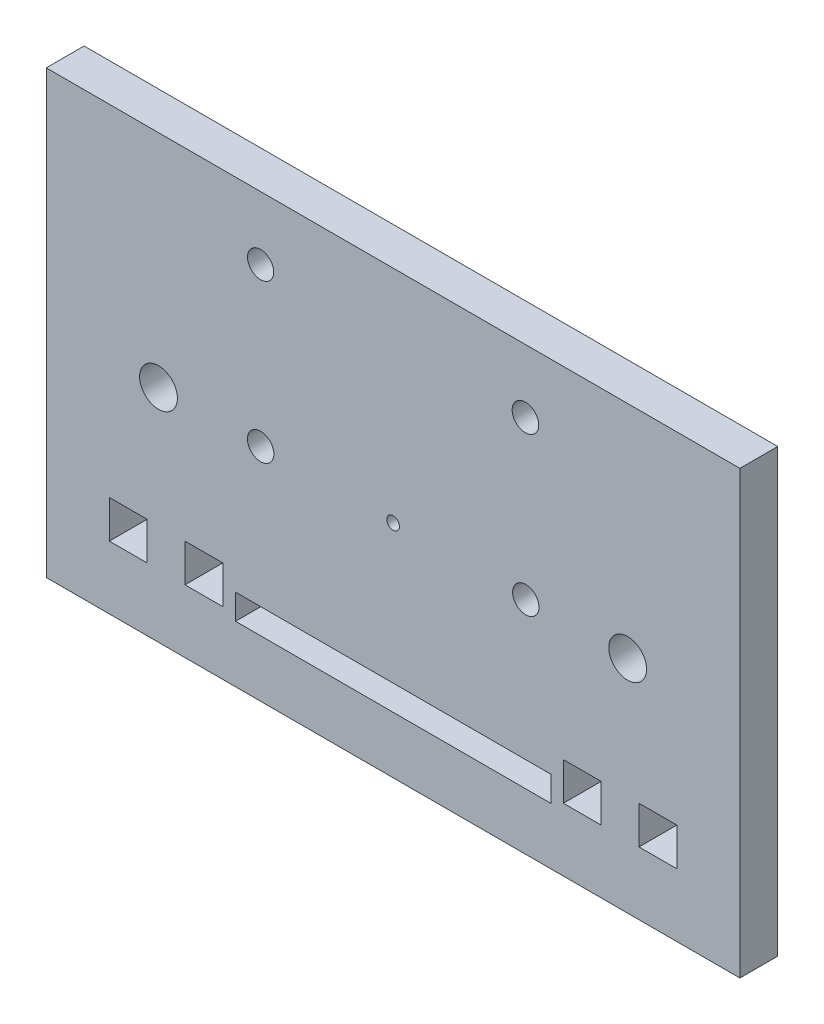
from build123d import *

# Parameters (mm, degrees)
SKETCH1_W           = 55
SKETCH1_H           = 35
SKETCH1_R           = 1.5
SKETCH1_R_2         = 0.5
BOSS_EXTRUDE1_DEPTH = 3
SKETCH2_W           = 25
SKETCH2_H           = 2
CUT_EXTRUDE1_DEPTH  = 4
SKETCH3_W           = 3
SKETCH3_H           = 3
CUT_EXTRUDE2_DEPTH  = 3
SKETCH4_R           = 1.047817358
SKETCH4_R_2         = 1.044805948
CUT_EXTRUDE3_DEPTH  = 3
SKETCH5_R           = 1.037971053
SKETCH5_R_2         = 1.052489193
CUT_EXTRUDE4_DEPTH  = 3


with BuildPart() as part:
    # Sketch1 → Boss-Extrude1 (new body)
    with BuildSketch(Plane.XY):
        Rectangle(SKETCH1_W, SKETCH1_H)
        with Locations((18.6, 0)):
            Circle(SKETCH1_R, mode=Mode.SUBTRACT)
        with Locations(Location((-18.6, 0, 0), (0, 0, 180))):
            Circle(SKETCH1_R, mode=Mode.SUBTRACT)
        Circle(SKETCH1_R_2, mode=Mode.SUBTRACT)
    extrude(amount=BOSS_EXTRUDE1_DEPTH)

    # Sketch2 → Cut-Extrude1 (cut)
    with BuildSketch(Plane.XY.offset(3)):
        with Locations((0.008423928, -12)):
            Rectangle(SKETCH2_W, SKETCH2_H)
    extrude(amount=-CUT_EXTRUDE1_DEPTH, mode=Mode.SUBTRACT)

    # Sketch3 → Cut-Extrude2 (cut)
    with BuildSketch(Plane.XY.offset(3)):
        with Locations((-21, -11)):
            Rectangle(SKETCH3_W, SKETCH3_H)
        with Locations((-15, -11)):
            Rectangle(SKETCH3_W, SKETCH3_H)
        with Locations((15, -11)):
            Rectangle(SKETCH3_W, SKETCH3_H)
        with Locations((21, -11)):
            Rectangle(SKETCH3_W, SKETCH3_H)
    extrude(amount=-CUT_EXTRUDE2_DEPTH, mode=Mode.SUBTRACT)

    # Sketch4 → Cut-Extrude3 (cut)
    with BuildSketch(Plane.XY.offset(3)):
        with Locations((-10.502321648, -0.002631042)):
            Circle(SKETCH4_R)
        with Locations((10.523984619, -0.009290749)):
            Circle(SKETCH4_R_2)
    extrude(amount=-CUT_EXTRUDE3_DEPTH, mode=Mode.SUBTRACT)

    # Sketch5 → Cut-Extrude4 (cut)
    with BuildSketch(Plane.XY.offset(3)):
        with Locations((-10.504210452, 12.485998178)):
            Circle(SKETCH5_R)
        with Locations((10.494217, 12.488375227)):
            Circle(SKETCH5_R_2)
    extrude(amount=-CUT_EXTRUDE4_DEPTH, mode=Mode.SUBTRACT)


solid = part.part
